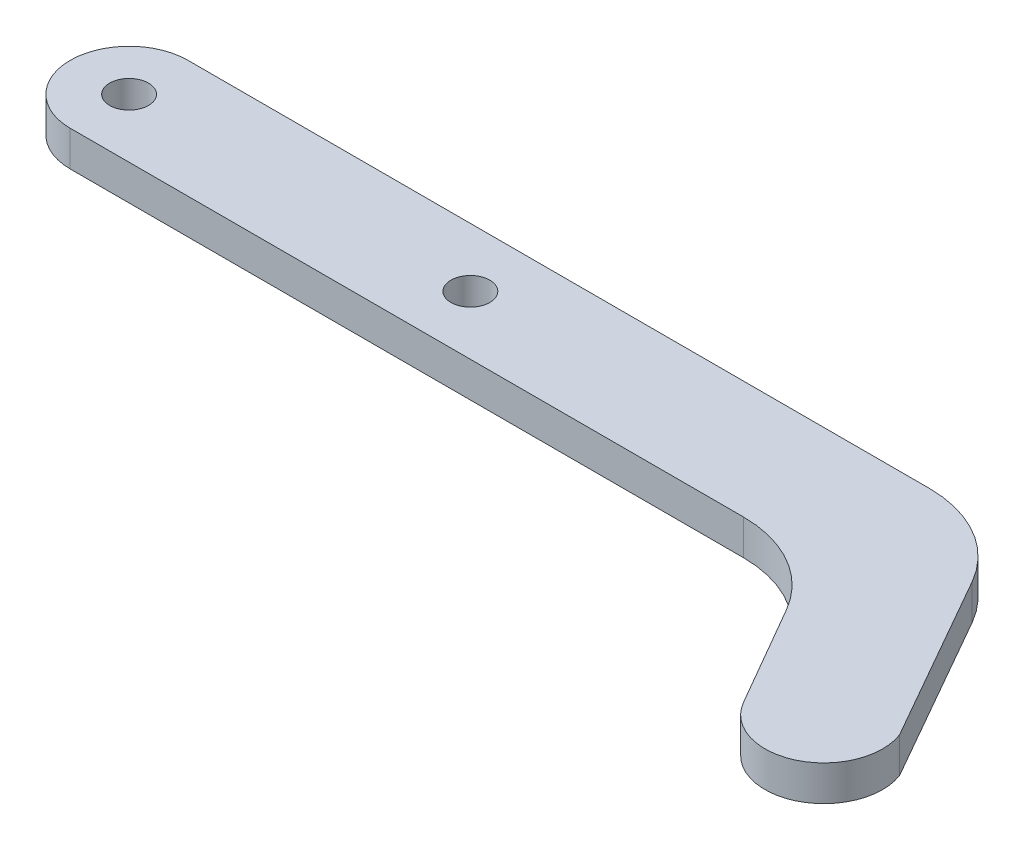
from build123d import *

# Parameters (mm, degrees)
SKETCH_1_R      = 1.65
EXTRUDE_1_DEPTH = 3


with BuildPart() as part:
    # 草图1 → 凸台-拉伸1 (new body)
    with BuildSketch(Plane(origin=(0, 0, 0), x_dir=(1, 0, 0), z_dir=(0, 1, 0))):
        with BuildLine():
            Line((0, 0), (57.2, 0))
            ThreePointArc((57.2, 0), (62.2, -1.339745962), (65.860254038, -5))
            Line((65.860254038, -5), (70.856051038, -13.652974229))
            ThreePointArc((70.856051038, -13.652974229), (77.317543945, -15.675946643), (79.870682341, -9.404998366))
            Line((79.870682341, -9.404998366), (71.687928066, 4.951757862))
            ThreePointArc((71.687928066, 4.951757862), (68.024063165, 8.646316517), (63, 10))
            Line((63, 10), (0, 10))
            ThreePointArc((0, 10), (-5, 5), (0, 0))
        make_face()
        with Locations(Location((0, 5, 0), (0, 0, 270))):
            Circle(SKETCH_1_R, mode=Mode.SUBTRACT)
        with Locations(Location((29, 5, 0), (0, 0, 270))):
            Circle(SKETCH_1_R, mode=Mode.SUBTRACT)
    extrude(amount=EXTRUDE_1_DEPTH)


solid = part.part
